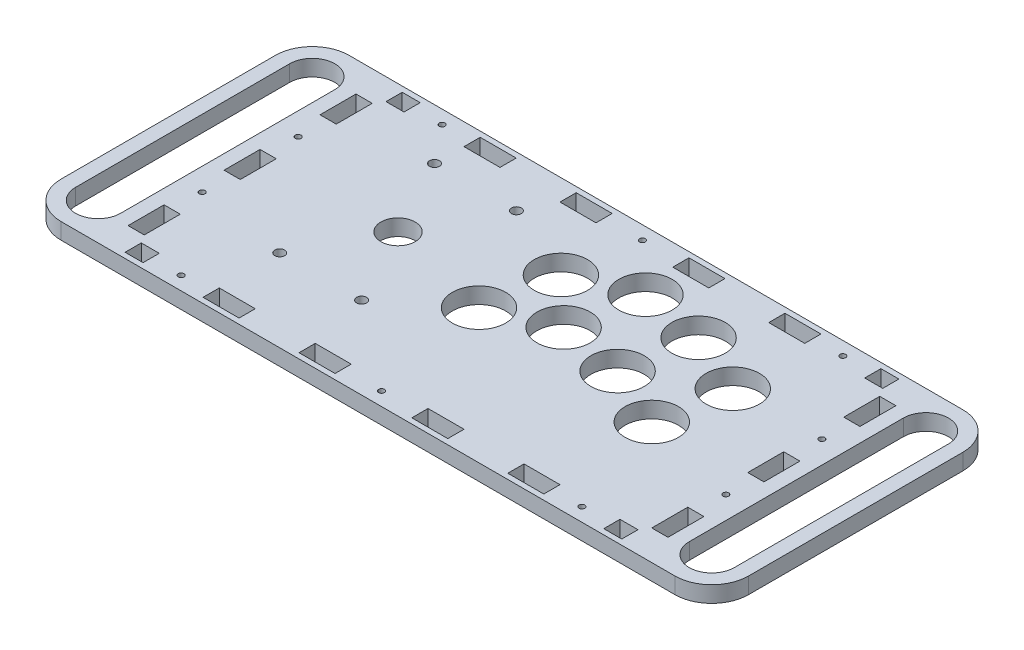
from build123d import *

# Parameters (mm, degrees)
SKETCH1_W                 = 300
SKETCH1_H                 = 160
BOSS_EXTRUDE1_DEPTH       = 9
SKETCH2_R                 = 14.825
SKETCH2_R_2               = 9.5
SKETCH2_R_3               = 2.75
MAIN_BUTTONS_DEPTH        = 171.238068598
SKETCH4_R                 = 1.6
SKETCH4_W                 = 9
SKETCH4_H                 = 20
LEFT_MOUNT_DEPTH          = 171.238068598
HANDLE_DEPTH              = 9
SKETCH6_W                 = 10
SKETCH6_H                 = 9
SKETCH6_W_2               = 20
CUT_EXTRUDE1_DEPTH        = 208.272767145
SKETCH7_W                 = 20
SKETCH7_H                 = 9
CUT_EXTRUDE2_DEPTH        = 208.272767145
SKETCH8_R                 = 1.6
M3_CLEARANCE_HOLES_DEPTH  = 208.272767145
MIRROR4_COPY_1_SKETCH_W   = 10
MIRROR4_COPY_1_SKETCH_H   = 9
MIRROR4_COPY_1_SKETCH_W_2 = 20
MIRROR4_COPY_1_DEPTH      = 208.272767145


with BuildPart() as part:
    # Sketch1 → Boss-Extrude1 (new body)
    with BuildSketch(Plane(origin=(0, 0, 0), x_dir=(1, 0, 0), z_dir=(0, 1, 0))):
        Rectangle(SKETCH1_W, SKETCH1_H)
    extrude(amount=BOSS_EXTRUDE1_DEPTH)

    # Sketch2 → main buttons (cut, through all)
    with BuildSketch(Plane(origin=(0, 9, 0), x_dir=(1, 0, 0), z_dir=(0, 1, 0))):
        with Locations(Location((-13, -5.325, 0), (0, 0, 270))):
            Circle(SKETCH2_R)
        with Locations(Location((20, 8.675, 0), (0, 0, 270))):
            Circle(SKETCH2_R)
        with Locations(Location((56, 2.675, 0), (0, 0, 270))):
            Circle(SKETCH2_R)
        with Locations(Location((90, -12.325, 0), (0, 0, 270))):
            Circle(SKETCH2_R)
        with Locations(Location((-72, 8.675, 0), (0, 0, 270))):
            Circle(SKETCH2_R_2)
        with Locations(Location((-94.75, 51.675, 0), (0, 0, 270))):
            Circle(SKETCH2_R_3)
        with Locations(Location((-49.25, 51.675, 0), (0, 0, 270))):
            Circle(SKETCH2_R_3)
        with Locations(Location((-94.75, -34.325, 0), (0, 0, 270))):
            Circle(SKETCH2_R_3)
        with Locations(Location((-49.25, -34.325, 0), (0, 0, 270))):
            Circle(SKETCH2_R_3)
        with Locations(Location((-6, 33.175, 0), (0, 0, 270))):
            Circle(SKETCH2_R)
        with Locations(Location((27, 47.175, 0), (0, 0, 270))):
            Circle(SKETCH2_R)
        with Locations(Location((62.5, 41.175, 0), (0, 0, 270))):
            Circle(SKETCH2_R)
        with Locations(Location((96.5, 26.175, 0), (0, 0, 270))):
            Circle(SKETCH2_R)
    extrude(amount=-MAIN_BUTTONS_DEPTH, mode=Mode.SUBTRACT)

    # Sketch4 → left mount (cut, through all)
    with BuildSketch(Plane(origin=(0, 9, 0), x_dir=(1, 0, 0), z_dir=(0, 1, 0))):
        with Locations(Location((-145.5, -26.666666667, 0), (0, 0, 270))):
            Circle(SKETCH4_R)
        with Locations(Location((-145.5, 26.666666667, 0), (0, 0, 270))):
            Circle(SKETCH4_R)
        with Locations((-145.5, 53.333333333)):
            Rectangle(SKETCH4_W, SKETCH4_H)
        with Locations((-145.5, 0)):
            Rectangle(SKETCH4_W, SKETCH4_H)
        with Locations((-145.5, -53.333333333)):
            Rectangle(SKETCH4_W, SKETCH4_H)
    left_mount = extrude(amount=-LEFT_MOUNT_DEPTH, mode=Mode.SUBTRACT)

    # Sketch3 → handle (add)
    with BuildSketch(Plane(origin=(0, 9, 0), x_dir=(1, 0, 0), z_dir=(0, 1, 0))):
        with BuildLine():
            Line((-150, -80), (-150, 80))
            Line((-150, 80), (-170.5, 80))
            ThreePointArc((-170.5, 80), (-184.995689014, 73.995689014), (-191, 59.5))
            Line((-191, 59.5), (-191, -59.5))
            ThreePointArc((-191, -59.5), (-184.995689014, -73.995689014), (-170.5, -80))
            Line((-170.5, -80), (-150, -80))
        make_face()
        with BuildLine():
            Line((-183, -59.5), (-183, 59.5))
            ThreePointArc((-183, 59.5), (-170.5, 72), (-158, 59.5))
            Line((-158, 59.5), (-158, -59.5))
            ThreePointArc((-158, -59.5), (-170.5, -72), (-183, -59.5))
        make_face(mode=Mode.SUBTRACT)
    handle = extrude(amount=-HANDLE_DEPTH)

    # Mirror1: left mount, handle across plane
    add(left_mount.mirror(Plane(origin=(0, 0, 0), x_dir=(0, 0, 1), z_dir=(1, 0, 0))), mode=Mode.SUBTRACT)
    add(handle.mirror(Plane(origin=(0, 0, 0), x_dir=(0, 0, 1), z_dir=(1, 0, 0))))

    # Sketch6 → Cut-Extrude1 (cut, through all)
    with BuildSketch(Plane(origin=(0, 9, 0), x_dir=(1, 0, 0), z_dir=(0, 1, 0))):
        with Locations((133, 72.5)):
            Rectangle(SKETCH6_W, SKETCH6_H)
        with Locations((84.666666667, 72.5)):
            Rectangle(SKETCH6_W_2, SKETCH6_H)
    cut_extrude1 = extrude(amount=-CUT_EXTRUDE1_DEPTH, mode=Mode.SUBTRACT)

    # Mirror3: Cut-Extrude1 across plane
    add(cut_extrude1.mirror(Plane(origin=(0, 0, 0), x_dir=(0, 0, 1), z_dir=(1, 0, 0))), mode=Mode.SUBTRACT)

    # Sketch7 → Cut-Extrude2 (cut, through all)
    with BuildSketch(Plane(origin=(0, 9, 0), x_dir=(1, 0, 0), z_dir=(0, 1, 0))):
        with Locations((31.333333333, 72.5)):
            Rectangle(SKETCH7_W, SKETCH7_H)
        with Locations((-31.333333333, 72.5)):
            Rectangle(SKETCH7_W, SKETCH7_H)
    cut_extrude2 = extrude(amount=-CUT_EXTRUDE2_DEPTH, mode=Mode.SUBTRACT)

    # Sketch8 → M3 clearance holes (cut, through all)
    with BuildSketch(Plane(origin=(0, 9, 0), x_dir=(1, 0, 0), z_dir=(0, 1, 0))):
        with Locations(Location((-111.333333333, 72.5, 0), (0, 0, 270))):
            Circle(SKETCH8_R)
        with Locations(Location((0, 72.5, 0), (0, 0, 270))):
            Circle(SKETCH8_R)
        with Locations(Location((111.333333333, 72.5, 0), (0, 0, 270))):
            Circle(SKETCH8_R)
    m3_clearance_holes = extrude(amount=-M3_CLEARANCE_HOLES_DEPTH, mode=Mode.SUBTRACT)

    # Mirror4: Cut-Extrude1, Cut-Extrude2, M3 clearance holes across plane
    add(cut_extrude1.mirror(Plane.XY), mode=Mode.SUBTRACT)
    add(cut_extrude2.mirror(Plane.XY), mode=Mode.SUBTRACT)
    add(m3_clearance_holes.mirror(Plane.XY), mode=Mode.SUBTRACT)

    # Mirror4 copy 1 sketch → Mirror4 copy 1 (cut, through all)
    with BuildSketch(Plane(origin=(0, 9, 0), x_dir=(-1, 0, 0), z_dir=(0, 1, 0))):
        with Locations((133, 72.5)):
            Rectangle(MIRROR4_COPY_1_SKETCH_W, MIRROR4_COPY_1_SKETCH_H)
        with Locations((84.666666667, 72.5)):
            Rectangle(MIRROR4_COPY_1_SKETCH_W_2, MIRROR4_COPY_1_SKETCH_H)
    extrude(amount=-MIRROR4_COPY_1_DEPTH, mode=Mode.SUBTRACT)


solid = part.part
